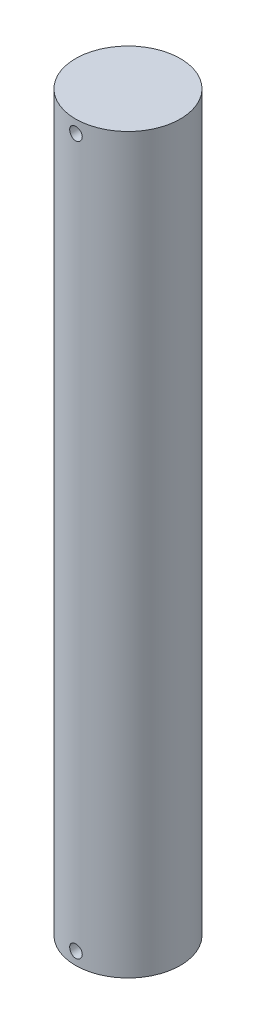
from build123d import *

# Parameters (mm, degrees)
SKETCH1_R           = 250
BOSS_EXTRUDE1_DEPTH = 3500
SKETCH2_R           = 30
CUT_EXTRUDE1_DEPTH  = 1500


with BuildPart() as part:
    # Sketch1 → Boss-Extrude1 (new body)
    with BuildSketch(Plane(origin=(0, 0, 0), x_dir=(1, 0, 0), z_dir=(0, 1, 0))):
        with Locations(Location((0, 0, 0), (0, 0, 270))):
            Circle(SKETCH1_R)
    extrude(amount=BOSS_EXTRUDE1_DEPTH)

    # Sketch2 → Cut-Extrude1 (cut, symmetric)
    with BuildSketch(Plane.XY):
        with Locations(Location((0, 3440, 0), (0, 0, 90))):
            Circle(SKETCH2_R)
        with Locations(Location((0, 60, 0), (0, 0, 90))):
            Circle(SKETCH2_R)
    extrude(amount=CUT_EXTRUDE1_DEPTH, both=True, mode=Mode.SUBTRACT)


solid = part.part
